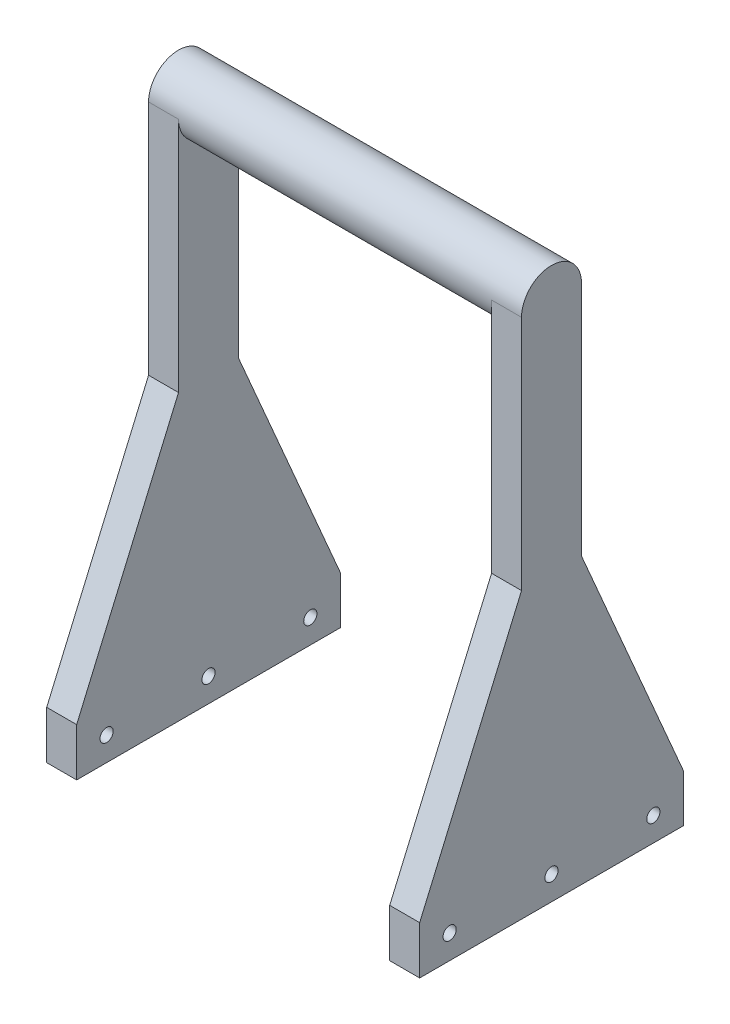
from build123d import *

# Parameters (mm, degrees)
SKETCH_2_W          = 10
SKETCH_2_H          = 88
EXTRUDE_1_DEPTH     = 16
EXTRUDE_1_2_DEPTH   = 16
SKETCH_3_W          = 10
SKETCH_3_H          = 20
EXTRUDE_2_DEPTH     = 158
SKETCH_4_R          = 10
EXTRUDE_3_DEPTH     = 124.5
SKETCH_5_R          = 2.2
CUT_EXTRUDE_1_DEPTH = 126
EXTRUDE_4_DEPTH     = 10
EXTRUDE_5_DEPTH     = 10


with BuildPart() as part:
    # 草图2 → 凸台-拉伸1 (new body)
    with BuildSketch(Plane(origin=(0, 0, 0), x_dir=(1, 0, 0), z_dir=(0, 1, 0))):
        with Locations((-57.25, 0)):
            Rectangle(SKETCH_2_W, SKETCH_2_H)
    extrude(amount=EXTRUDE_1_DEPTH)



with BuildPart() as body_2:
    # 草图2 → Extrude 1 2 (new body)
    with BuildSketch(Plane(origin=(0, 0, 0), x_dir=(1, 0, 0), z_dir=(0, 1, 0))):
        with Locations((57.25, 0)):
            Rectangle(SKETCH_2_W, SKETCH_2_H)
    extrude(amount=EXTRUDE_1_2_DEPTH)


with BuildPart() as part_1:
    add(part.part)

    add(body_2.part)  # 凸台-拉伸2 merges body 2
    # 草图3 → 凸台-拉伸2 (add)
    with BuildSketch(Plane(origin=(0, 16, 0), x_dir=(1, 0, 0), z_dir=(0, 1, 0))):
        with Locations((-57.25, 0)):
            Rectangle(SKETCH_3_W, SKETCH_3_H)
        with Locations((57.25, 0)):
            Rectangle(SKETCH_3_W, SKETCH_3_H)
    extrude(amount=EXTRUDE_2_DEPTH)

    # 草图4 → 凸台-拉伸3 (add)
    with BuildSketch(Plane.ZY.offset(62.25)):
        with Locations((0, 174)):
            Circle(SKETCH_4_R)
    extrude(amount=-EXTRUDE_3_DEPTH)

    # 草图5 → 切除-拉伸1 (cut)
    with BuildSketch(Plane.ZY.offset(62.25)):
        with Locations((0, 8)):
            Circle(SKETCH_5_R)
        with Locations((-34, 8)):
            Circle(SKETCH_5_R)
        with Locations((34, 8)):
            Circle(SKETCH_5_R)
    extrude(amount=-CUT_EXTRUDE_1_DEPTH, mode=Mode.SUBTRACT)

    # 草图6 → 凸台-拉伸4 (add)
    with BuildSketch(Plane.ZY.offset(62.25)):
        Polygon((-44, 16), (-10, 95), (-10, 16), align=None)
        Polygon((44, 16), (10, 95), (10, 16), align=None)
    extrude(amount=-EXTRUDE_4_DEPTH)

    # 草图7 → 凸台-拉伸5 (add)
    with BuildSketch(Plane(origin=(62.25, 0, 0), x_dir=(0, 0, -1), z_dir=(1, 0, 0))):
        Polygon((-44, 16), (-10, 95), (-10, 16), align=None)
        Polygon((44, 16), (10, 95), (10, 16), align=None)
    extrude(amount=-EXTRUDE_5_DEPTH)


solid = part_1.part
